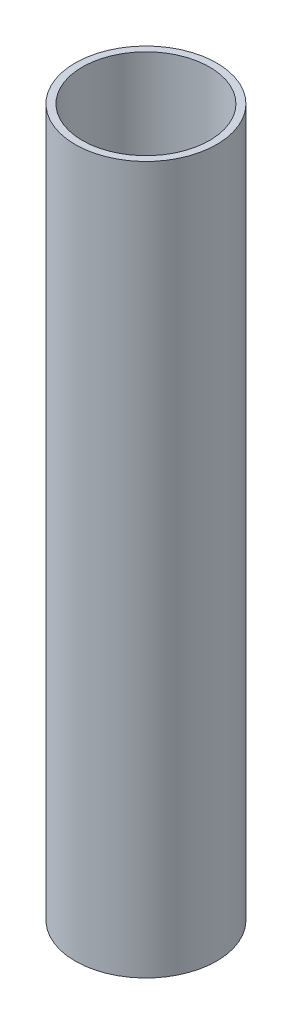
from build123d import *

# Parameters (mm, degrees)
SKETCH1_R           = 20
SKETCH1_R_2         = 18
BOSS_EXTRUDE1_DEPTH = 200


with BuildPart() as part:
    # Sketch1 → Boss-Extrude1 (new body)
    with BuildSketch(Plane(origin=(0, 0, 0), x_dir=(1, 0, 0), z_dir=(0, 1, 0))):
        with Locations(Location((0, 0, 0), (0, 0, 270))):
            Circle(SKETCH1_R)
        with Locations(Location((0, 0, 0), (0, 0, 270))):
            Circle(SKETCH1_R_2, mode=Mode.SUBTRACT)
    extrude(amount=BOSS_EXTRUDE1_DEPTH)


solid = part.part
